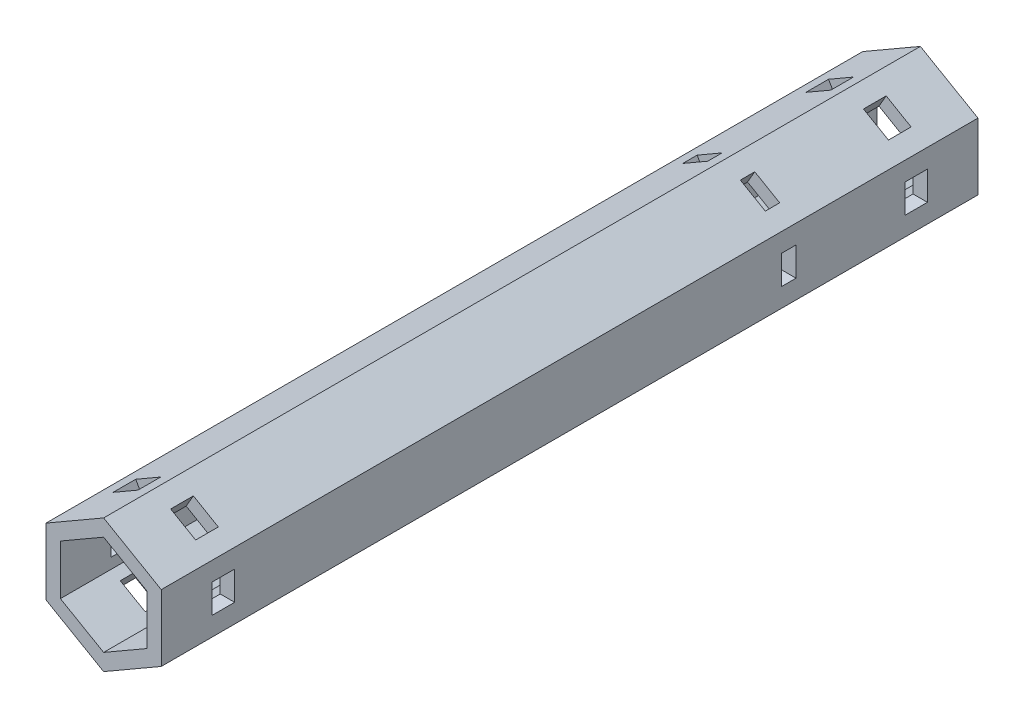
from build123d import *

# Parameters (mm, degrees)
BOSS_EXTRUDE1_DEPTH     = 90
CUT_EXTRUDE2_DEPTH      = 3.175
CUT_EXTRUDE2_DEPTH_BACK = 3.175
SKETCH4_W               = 3.175
SKETCH4_H               = 5
SKETCH4_H_2             = 3.175
CUT_EXTRUDE3_DEPTH      = 3.175
CUT_EXTRUDE3_DEPTH_BACK = 3.175
SKETCH7_W               = 5
SKETCH7_H               = 3.175
SKETCH7_W_2             = 3.175
CUT_EXTRUDE4_DEPTH      = 3.175
CUT_EXTRUDE4_DEPTH_BACK = 3.175
SKETCH8_W               = 5
SKETCH8_H               = 3.175
SKETCH8_W_2             = 3.175


with BuildPart() as part:
    # Sketch3 → Boss-Extrude1 (new, symmetric)
    with BuildSketch(Plane.XY):
        Polygon((0, 14.664696837), (-12.7, 7.332348419), (-12.7, -7.332348419), (0, -14.664696837), (12.7, -7.332348419), (12.7, 7.332348419), align=None)
        Polygon((0, 10.998522628), (9.525, 5.499261314), (9.525, -5.499261314), (0, -10.998522628), (-9.525, -5.499261314), (-9.525, 5.499261314), align=None, mode=Mode.SUBTRACT)
    extrude(amount=BOSS_EXTRUDE1_DEPTH, both=True)

    # Sketch4 → Cut-Extrude2 (cut, two sides: drawn at the far end of the back side and taken through both)
    with BuildSketch(Plane(origin=(0, 0, 0), x_dir=(1, 0, 0), z_dir=(0, 1, 0)).offset(-CUT_EXTRUDE2_DEPTH_BACK)):
        with Locations((-11.1125, -76.325394791)):
            Rectangle(SKETCH4_W, SKETCH4_H)
        with Locations((-11.1125, 48.311416829)):
            Rectangle(SKETCH4_W, SKETCH4_H_2)
        with Locations((11.1125, 76.360728449)):
            Rectangle(SKETCH4_W, SKETCH4_H)
        with Locations((11.1125, 48.311416829)):
            Rectangle(SKETCH4_W, SKETCH4_H_2)
        with Locations((11.1125, -76.325394791)):
            Rectangle(SKETCH4_W, SKETCH4_H)
        with Locations((-11.1125, 76.360728449)):
            Rectangle(SKETCH4_W, SKETCH4_H)
    extrude(amount=CUT_EXTRUDE2_DEPTH + CUT_EXTRUDE2_DEPTH_BACK, mode=Mode.SUBTRACT)

    # Sketch7 → Cut-Extrude3 (cut, two sides: drawn at the far end of the back side and taken through both)
    with BuildSketch(Plane(origin=(0, 0, 0), x_dir=(0, 0, 1), z_dir=(-0.8660254037844387, 0.4999999999999999, 0)).offset(-CUT_EXTRUDE3_DEPTH_BACK)):
        with Locations((76.325394791, -11.1125)):
            Rectangle(SKETCH7_W, SKETCH7_H)
        with Locations((-48.311416829, -11.1125)):
            Rectangle(SKETCH7_W_2, SKETCH7_H)
        with Locations((-76.360728449, 11.1125)):
            Rectangle(SKETCH7_W, SKETCH7_H)
        with Locations((-48.311416829, 11.1125)):
            Rectangle(SKETCH7_W_2, SKETCH7_H)
        with Locations((76.325394791, 11.1125)):
            Rectangle(SKETCH7_W, SKETCH7_H)
        with Locations((-76.360728449, -11.1125)):
            Rectangle(SKETCH7_W, SKETCH7_H)
    extrude(amount=CUT_EXTRUDE3_DEPTH + CUT_EXTRUDE3_DEPTH_BACK, mode=Mode.SUBTRACT)

    # Sketch8 → Cut-Extrude4 (cut, two sides: drawn at the far end of the back side and taken through both)
    with BuildSketch(Plane(origin=(0, 0, 0), x_dir=(0, 0, 1), z_dir=(-0.8660254037844387, -0.4999999999999999, 0)).offset(-CUT_EXTRUDE4_DEPTH_BACK)):
        with Locations((76.325394791, -11.1125)):
            Rectangle(SKETCH8_W, SKETCH8_H)
        with Locations((-48.311416829, -11.1125)):
            Rectangle(SKETCH8_W_2, SKETCH8_H)
        with Locations((-76.360728449, 11.1125)):
            Rectangle(SKETCH8_W, SKETCH8_H)
        with Locations((-48.311416829, 11.1125)):
            Rectangle(SKETCH8_W_2, SKETCH8_H)
        with Locations((76.325394791, 11.1125)):
            Rectangle(SKETCH8_W, SKETCH8_H)
        with Locations((-76.360728449, -11.1125)):
            Rectangle(SKETCH8_W, SKETCH8_H)
    extrude(amount=CUT_EXTRUDE4_DEPTH + CUT_EXTRUDE4_DEPTH_BACK, mode=Mode.SUBTRACT)


solid = part.part
